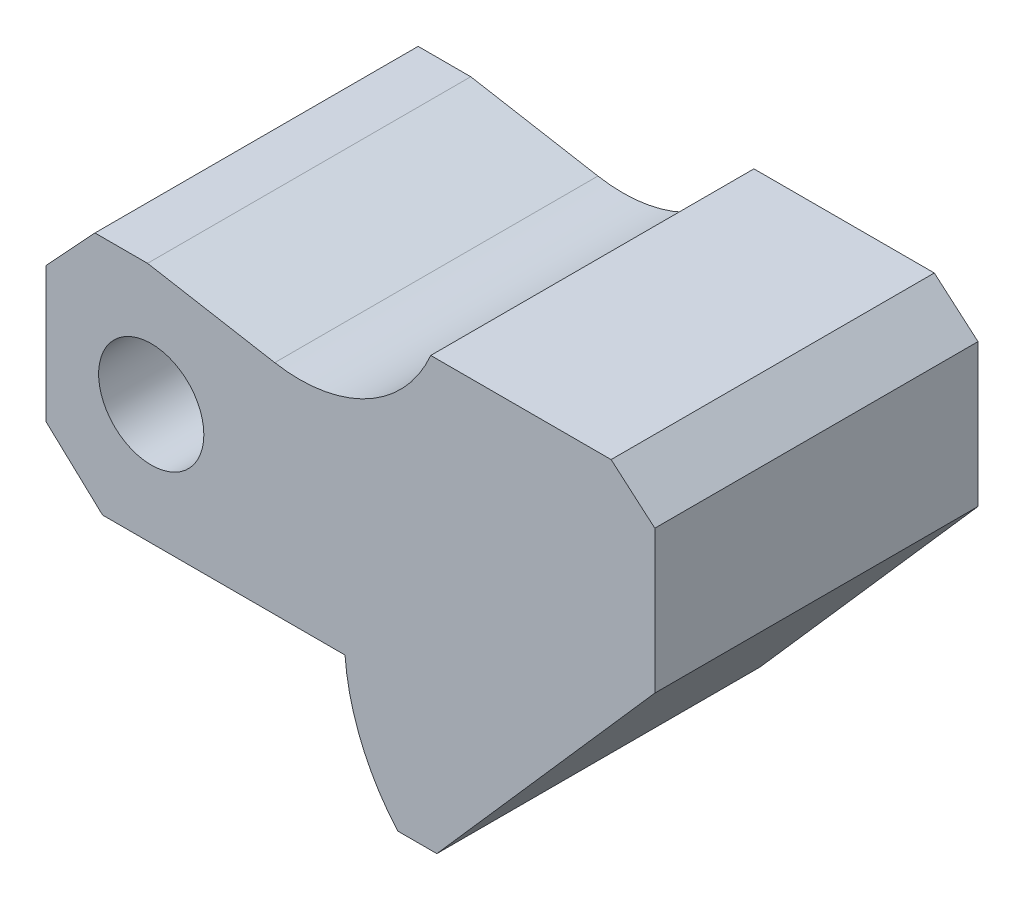
from build123d import *

# Parameters (mm, degrees)
SKETCH3_R           = 7
BOSS_EXTRUDE1_DEPTH = 43


with BuildPart() as part:
    # Sketch3 → Boss-Extrude1 (new body)
    with BuildSketch(Plane.XY):
        with BuildLine():
            Line((-18.766263872, -12.144286576), (13.491947319, -12.144286576))
            ThreePointArc((13.491947319, -12.144286576), (15.646337823, -21.094858365), (20.497554358, -28.919168681))
            Line((20.497554358, -28.919168681), (25.709486961, -28.919168681))
            Line((25.709486961, -28.919168681), (54.709486961, 4.080831319))
            Line((54.709486961, 4.080831319), (54.709486961, 23.080831319))
            Line((54.709486961, 23.080831319), (48.896751189, 28.080831319))
            Line((48.896751189, 28.080831319), (24.896751189, 28.080831319))
            ThreePointArc((24.896751189, 28.080831319), (16.469153092, 18.865687614), (4.141554757, 16.872297921))
            Line((4.141554757, 16.872297921), (-12.778235346, 19.855713424))
            Line((-12.778235346, 19.855713424), (-19.778235346, 19.855713424))
            Line((-19.778235346, 19.855713424), (-26.290513039, 12.855713424))
            Line((-26.290513039, 12.855713424), (-26.290513039, -5.144286576))
            Line((-26.290513039, -5.144286576), (-18.766263872, -12.144286576))
        make_face()
        with Locations((-12.290513039, 3.855713424)):
            Circle(SKETCH3_R, mode=Mode.SUBTRACT)
    extrude(amount=BOSS_EXTRUDE1_DEPTH)


solid = part.part
